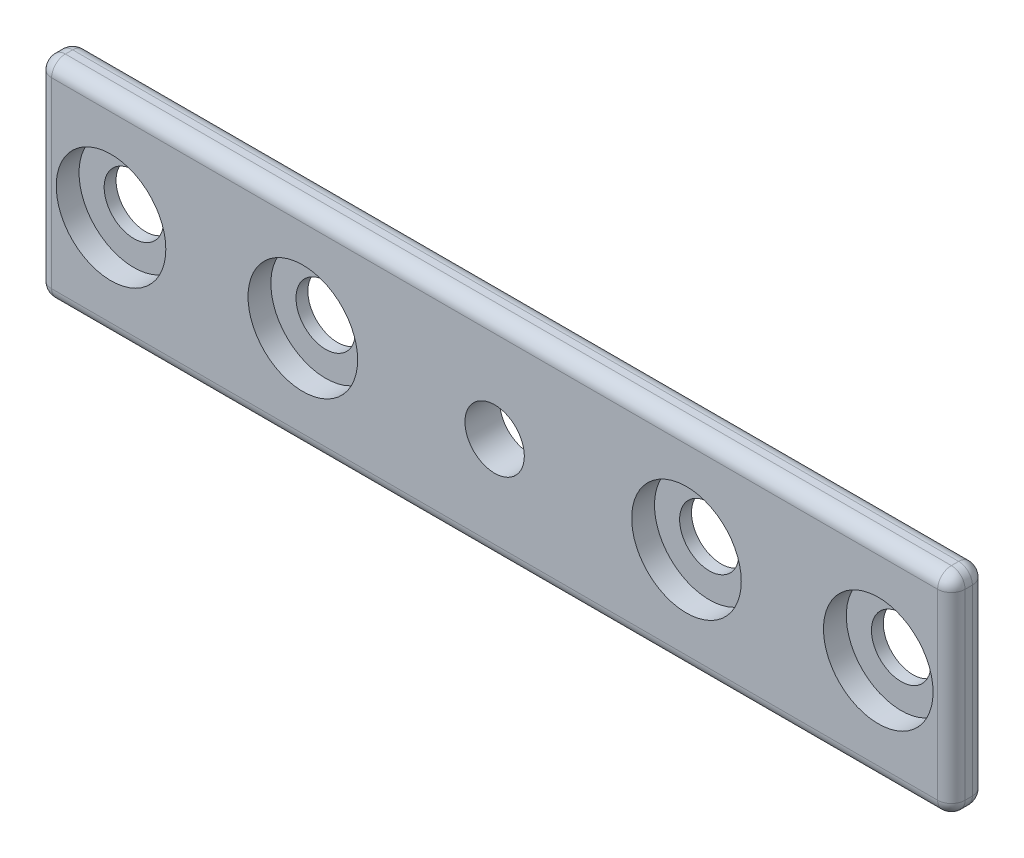
from build123d import *

# Parameters (mm, degrees)
SKETCH1_W           = 100
SKETCH1_H           = 23
BOSS_EXTRUDE1_DEPTH = 3.8
SKETCH2_R           = 3.25
CUT_EXTRUDE1_DEPTH  = 103.681254375
SKETCH3_R           = 6
CUT_EXTRUDE5_DEPTH  = 2.5
FILLET1_R           = 1.5


with BuildPart() as part:
    # Sketch1 → Boss-Extrude1 (new body)
    with BuildSketch(Plane.XY):
        with Locations((50, 11.5)):
            Rectangle(SKETCH1_W, SKETCH1_H)
    extrude(amount=BOSS_EXTRUDE1_DEPTH)

    # Sketch2 → Cut-Extrude1 (cut, through all)
    with BuildSketch(Plane.XY.offset(3.8)):
        with Locations((8, 11.5)):
            Circle(SKETCH2_R)
        with Locations((29, 11.5)):
            Circle(SKETCH2_R)
        with Locations((50, 11.5)):
            Circle(SKETCH2_R)
        with Locations((71, 11.5)):
            Circle(SKETCH2_R)
        with Locations((92, 11.5)):
            Circle(SKETCH2_R)
    extrude(amount=-CUT_EXTRUDE1_DEPTH, mode=Mode.SUBTRACT)

    # Sketch3 → Cut-Extrude5 (cut)
    with BuildSketch(Plane.XY.offset(3.8)):
        with Locations((8, 11.5)):
            Circle(SKETCH3_R)
        with Locations((29, 11.5)):
            Circle(SKETCH3_R)
        with Locations((71, 11.5)):
            Circle(SKETCH3_R)
        with Locations((92, 11.5)):
            Circle(SKETCH3_R)
    extrude(amount=-CUT_EXTRUDE5_DEPTH, mode=Mode.SUBTRACT)

    # Fillet1
    fillet1_edges = [part.edges().sort_by_distance(p)[0] for p in [
        (100, 11.5, 3.8),
        (50, 23, 3.8),
        (0, 11.5, 3.8),
        (50, 23, 0),
        (100, 11.5, 0),
        (50, 0, 0),
        (0, 11.5, 0),
        (0, 23, 1.9),
        (100, 23, 1.9),
        (100, 0, 1.9),
        (0, 0, 1.9),
        (50, 0, 3.8),
    ]]
    fillet(fillet1_edges, radius=FILLET1_R)


solid = part.part
